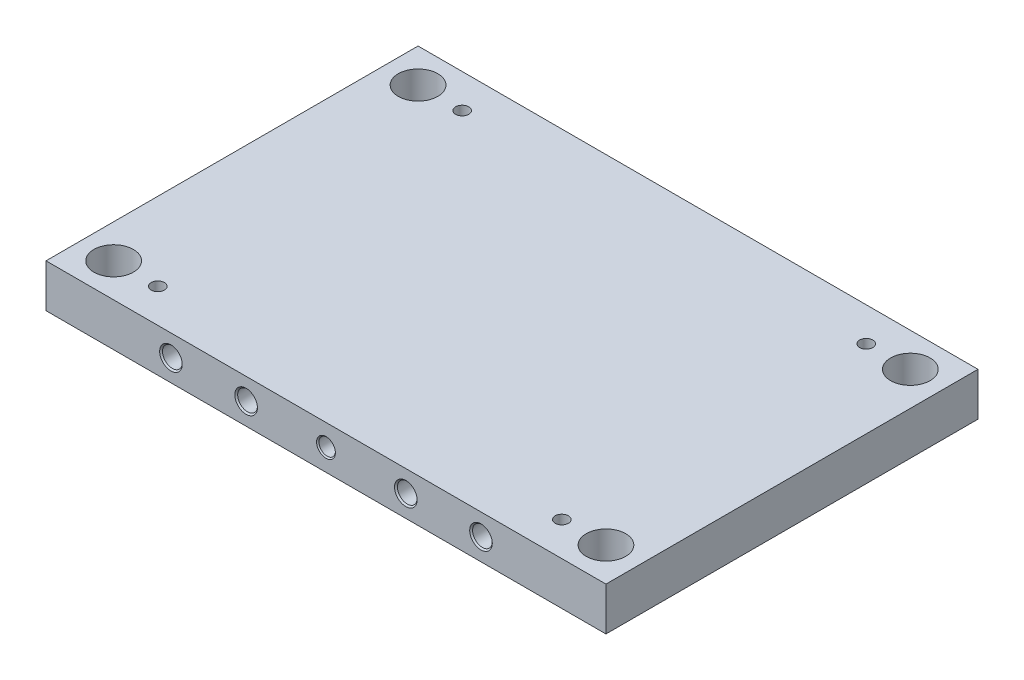
from build123d import *

# Parameters (mm, degrees)
SZKIC1_W                          = 596
SZKIC1_H                          = 396
SZKIC1_R                          = 24
SZKIC1_R_2                        = 21
DODANIE_WYCI_GNI_CIE1_DEPTH       = 46
OTW_R_GWINTOWANY_M161_D           = 14
SZKIC5_R                          = 5
WYTNIJ_WYCI_GNI_CIE1_DEPTH        = 718.041142474
OTW_R_GWINTOWANY_M241_AT_2_COUNT  = 2
OTW_R_GWINTOWANY_M241_AT_2_PITCH  = 80
OTW_R_GWINTOWANY_M241_AT_3_COUNT  = 2
OTW_R_GWINTOWANY_M241_AT_3_PITCH  = 170
OTW_R_GWINTOWANY_M241_AT_4_COUNT  = 2
OTW_R_GWINTOWANY_M241_AT_4_PITCH  = 250
OTW_R_GWINTOWANY_M201_D           = 17.5
OTW_R_GWINTOWANY_M201_DEPTH       = 52.5
OTW_R_GWINTOWANY_M201_CSINK_D     = 20.05
OTW_R_GWINTOWANY_M201_CSINK_ANGLE = 90
OTW_R_GWINTOWANY_M201_TIP         = 5.257530416


with BuildPart() as part:
    # Szkic1 → Dodanie-wyciągnięcie1 (new body)
    # profile 1 of 5: a face of its own
    with BuildSketch(Plane(origin=(0, 0, 0), x_dir=(1, 0, 0), z_dir=(0, 1, 0))):
        with Locations((298, 198)):
            Rectangle(SZKIC1_W, SZKIC1_H)
        with Locations((560, 360)):
            Circle(SZKIC1_R, mode=Mode.SUBTRACT)
        with Locations((36, 360)):
            Circle(SZKIC1_R, mode=Mode.SUBTRACT)
        with Locations((560, 36)):
            Circle(SZKIC1_R, mode=Mode.SUBTRACT)
        with Locations((36, 36)):
            Circle(SZKIC1_R, mode=Mode.SUBTRACT)
    # profile 2 of 5: a face of its own
    with BuildSketch(Plane(origin=(0, 0, 0), x_dir=(1, 0, 0), z_dir=(0, 1, 0))):
        with Locations((36, 36)):
            Circle(SZKIC1_R)
        with Locations(Location((36, 36, 0), (0, 0, 270))):
            Circle(SZKIC1_R_2, mode=Mode.SUBTRACT)
    # profile 3 of 5: a face of its own
    with BuildSketch(Plane(origin=(0, 0, 0), x_dir=(1, 0, 0), z_dir=(0, 1, 0))):
        with Locations((560, 36)):
            Circle(SZKIC1_R)
        with Locations(Location((560, 36, 0), (0, 0, 270))):
            Circle(SZKIC1_R_2, mode=Mode.SUBTRACT)
    # profile 4 of 5: a face of its own
    with BuildSketch(Plane(origin=(0, 0, 0), x_dir=(1, 0, 0), z_dir=(0, 1, 0))):
        with Locations((560, 360)):
            Circle(SZKIC1_R)
        with Locations(Location((560, 360, 0), (0, 0, 270))):
            Circle(SZKIC1_R_2, mode=Mode.SUBTRACT)
    # profile 5 of 5: a face of its own
    with BuildSketch(Plane(origin=(0, 0, 0), x_dir=(1, 0, 0), z_dir=(0, 1, 0))):
        with Locations((36, 360)):
            Circle(SZKIC1_R)
        with Locations(Location((36, 360, 0), (0, 0, 270))):
            Circle(SZKIC1_R_2, mode=Mode.SUBTRACT)
    extrude(amount=-DODANIE_WYCI_GNI_CIE1_DEPTH)

    # Otwór gwintowany M161 (through all)
    with Locations(Plane(origin=(83, 0, -360), x_dir=(0, 0, 1), z_dir=(0, 1, 0))):
        with Locations((0, 0), (0, 430), (324, 0), (324, 430)):
            Hole(OTW_R_GWINTOWANY_M161_D / 2)

    # Szkic5 → Wytnij-wyciągnięcie1 (cut, through all)
    with BuildSketch(Plane.XY):
        with Locations((133, -23)):
            Circle(SZKIC5_R)
        with Locations((213, -23)):
            Circle(SZKIC5_R)
        with Locations(Location((463, -23, 0), (0, 0, 180))):
            Circle(SZKIC5_R)
        with Locations(Location((383, -23, 0), (0, 0, 180))):
            Circle(SZKIC5_R)
    extrude(amount=-WYTNIJ_WYCI_GNI_CIE1_DEPTH, mode=Mode.SUBTRACT)

    # Szkic6 → Otwór gwintowany M241 (revolve, cut)
    with BuildSketch(Plane(origin=(213, -23, 0), x_dir=(0, -1, 0), z_dir=(1, 0, 0))):
        Polygon((0, 0), (0, 41.3090365), (10.5, 35), (10.5, 1.525), (12.025, 0), align=None)
    otw_r_gwintowany_m241 = revolve(axis=Axis((213, -23, 6.35), (0, 0, -1)), mode=Mode.SUBTRACT)

    # Otwór gwintowany M241 at 2: Otwór gwintowany M241 ×2
    with Locations(*[(-i * OTW_R_GWINTOWANY_M241_AT_2_PITCH, 0, 0) for i in range(1, OTW_R_GWINTOWANY_M241_AT_2_COUNT)]):
        add(otw_r_gwintowany_m241, mode=Mode.SUBTRACT)

    # Otwór gwintowany M241 at 3: Otwór gwintowany M241 ×2
    with Locations(*[(i * OTW_R_GWINTOWANY_M241_AT_3_PITCH, 0, 0) for i in range(1, OTW_R_GWINTOWANY_M241_AT_3_COUNT)]):
        add(otw_r_gwintowany_m241, mode=Mode.SUBTRACT)

    # Otwór gwintowany M241 at 4: Otwór gwintowany M241 ×2
    with Locations(*[(i * OTW_R_GWINTOWANY_M241_AT_4_PITCH, 0, 0) for i in range(1, OTW_R_GWINTOWANY_M241_AT_4_COUNT)]):
        add(otw_r_gwintowany_m241, mode=Mode.SUBTRACT)

    # Lustro1: Otwór gwintowany M241 across plane
    add(otw_r_gwintowany_m241.mirror(Plane.XY.offset(-198)), mode=Mode.SUBTRACT)

    # Lustro1 copy 1 sketch → Lustro1 copy 1 (revolve, cut)
    with BuildSketch(Plane(origin=(133, -23, -396), x_dir=(0, -1, 0), z_dir=(1, 0, 0))):
        Polygon((0, 0), (0, -41.3090365), (10.5, -35), (10.5, -1.525), (12.025, 0), align=None)
    revolve(axis=Axis((133, -23, -402.35), (0, 0, -1)), mode=Mode.SUBTRACT)

    # Lustro1 copy 2 sketch → Lustro1 copy 2 (revolve, cut)
    with BuildSketch(Plane(origin=(383, -23, -396), x_dir=(0, -1, 0), z_dir=(1, 0, 0))):
        Polygon((0, 0), (0, -41.3090365), (10.5, -35), (10.5, -1.525), (12.025, 0), align=None)
    revolve(axis=Axis((383, -23, -402.35), (0, 0, -1)), mode=Mode.SUBTRACT)

    # Lustro1 copy 3 sketch → Lustro1 copy 3 (revolve, cut)
    with BuildSketch(Plane(origin=(463, -23, -396), x_dir=(0, -1, 0), z_dir=(1, 0, 0))):
        Polygon((0, 0), (0, -41.3090365), (10.5, -35), (10.5, -1.525), (12.025, 0), align=None)
    revolve(axis=Axis((463, -23, -402.35), (0, 0, -1)), mode=Mode.SUBTRACT)

    # Otwór gwintowany M201
    with Locations(Plane(origin=(298, -23, 0), x_dir=(1, 0, 0), z_dir=(0, 0, 1))):
        with Locations((0, 0)):
            CounterSinkHole(OTW_R_GWINTOWANY_M201_D / 2, OTW_R_GWINTOWANY_M201_CSINK_D / 2, depth=OTW_R_GWINTOWANY_M201_DEPTH, counter_sink_angle=OTW_R_GWINTOWANY_M201_CSINK_ANGLE)
            with Locations((0, 0, -(OTW_R_GWINTOWANY_M201_DEPTH + OTW_R_GWINTOWANY_M201_TIP / 2))):  # 118° drill point
                Cone(0, OTW_R_GWINTOWANY_M201_D / 2, OTW_R_GWINTOWANY_M201_TIP, mode=Mode.SUBTRACT)


solid = part.part
